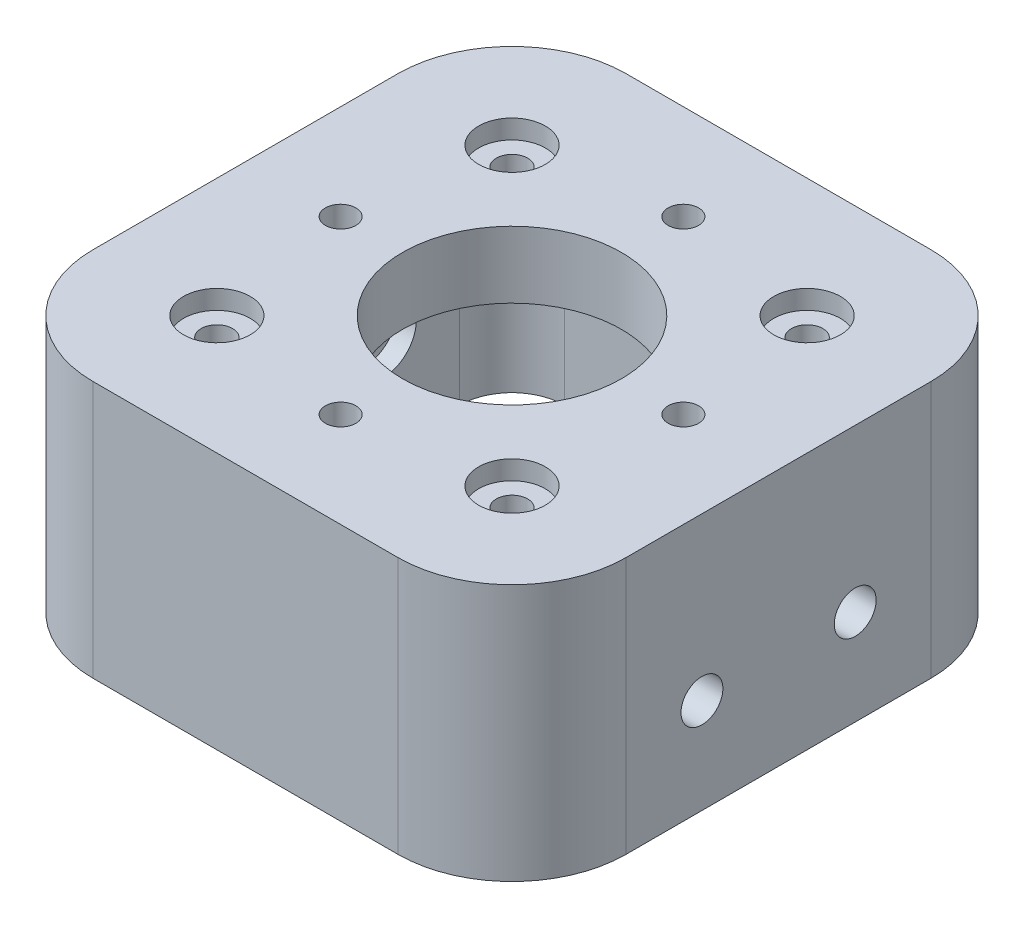
from build123d import *

# Parameters (mm, degrees)
SKETCH1_R           = 1.65
SKETCH1_R_2         = 11.5
BOSS_EXTRUDE1_DEPTH = 7
CUT_EXTRUDE3_DEPTH  = 3
BOSS_EXTRUDE4_START = -27
BOSS_EXTRUDE4_DEPTH = 27
CUT_EXTRUDE4_DEPTH  = 20
SKETCH7_R           = 2.2
CUT_EXTRUDE5_DEPTH  = 27
SKETCH8_R           = 3.5
CUT_EXTRUDE6_DEPTH  = 2
CUT_EXTRUDE7_START  = -8
SKETCH9_R           = 2.2
CUT_EXTRUDE7_DEPTH  = 8
CUT_EXTRUDE8_START  = -2
SKETCH10_R          = 3.5
CUT_EXTRUDE8_DEPTH  = 2
SKETCH11_R          = 3.5
CUT_EXTRUDE9_DEPTH  = 2
SKETCH12_R          = 1.6
CUT_EXTRUDE10_DEPTH = 7


with BuildPart() as part:
    # Sketch1 → Boss-Extrude1 (new body)
    with BuildSketch(Plane(origin=(0, 0, 0), x_dir=(1, 0, 0), z_dir=(0, 1, 0))):
        with BuildLine():
            Line((-35.480538417, 14.828911565), (-3.480538417, 14.828911565))
            ThreePointArc((-3.480538417, 14.828911565), (0.054995489, 13.364445471), (1.519461583, 9.828911565))
            Line((1.519461583, 9.828911565), (1.519461583, -22.171088435))
            ThreePointArc((1.519461583, -22.171088435), (0.054995489, -25.706622341), (-3.480538417, -27.171088435))
            Line((-3.480538417, -27.171088435), (-35.480538417, -27.171088435))
            ThreePointArc((-35.480538417, -27.171088435), (-39.016072323, -25.706622341), (-40.480538417, -22.171088435))
            Line((-40.480538417, -22.171088435), (-40.480538417, 9.828911565))
            ThreePointArc((-40.480538417, 9.828911565), (-39.016072323, 13.364445471), (-35.480538417, 14.828911565))
        make_face()
        with Locations(Location((-34.980538417, 9.328911565, 0), (0, 0, 270))):
            Circle(SKETCH1_R, mode=Mode.SUBTRACT)
        with Locations(Location((-3.980538417, 9.328911565, 0), (0, 0, 270))):
            Circle(SKETCH1_R, mode=Mode.SUBTRACT)
        with Locations(Location((-34.980538417, -21.671088435, 0), (0, 0, 270))):
            Circle(SKETCH1_R, mode=Mode.SUBTRACT)
        with Locations(Location((-3.980538417, -21.671088435, 0), (0, 0, 270))):
            Circle(SKETCH1_R, mode=Mode.SUBTRACT)
        with Locations(Location((-19.480538417, -6.171088435, 0), (0, 0, 270))):
            Circle(SKETCH1_R_2, mode=Mode.SUBTRACT)
    extrude(amount=BOSS_EXTRUDE1_DEPTH)

    # Sketch4 → Cut-Extrude3 (cut)
    with BuildSketch(Plane.XZ):
        Polygon((-22.480538417, 27.171088435), (-16.480538417, 27.171088435), (-16.480538417, 22.439037628), (-17.980538417, 21.573012224), (-19.480538417, 20.70698682), (-22.480538417, 22.439037628), align=None)
        Polygon((1.519461583, 3.171088435), (-3.212589224, 3.171088435), (-4.078614628, 4.671088435), (-4.944640032, 6.171088435), (-3.212589224, 9.171088435), (1.519461583, 9.171088435), align=None)
        Polygon((-22.480538417, -14.828911565), (-22.480538417, -10.096860757), (-20.980538417, -9.230835353), (-19.480538417, -8.364809949), (-16.480538417, -10.096860757), (-16.480538417, -14.828911565), align=None)
        Polygon((-40.480538417, 9.171088435), (-35.748487609, 9.171088435), (-34.882462206, 7.671088435), (-34.016436802, 6.171088435), (-35.748487609, 3.171088435), (-40.480538417, 3.171088435), align=None)
    extrude(amount=-CUT_EXTRUDE3_DEPTH, mode=Mode.SUBTRACT)

    # Sketch5 → Boss-Extrude4 (add)
    with BuildSketch(Plane(origin=(0, 7, 0), x_dir=(1, 0, 0), z_dir=(0, 1, 0)).offset(BOSS_EXTRUDE4_START)):
        with BuildLine():
            Line((-47.480538417, 9.828911565), (-47.480538417, -22.171088435))
            ThreePointArc((-47.480538417, -22.171088435), (-43.965819791, -30.65636981), (-35.480538417, -34.171088435))
            Line((-35.480538417, -34.171088435), (-3.480538417, -34.171088435))
            ThreePointArc((-3.480538417, -34.171088435), (5.004742957, -30.65636981), (8.519461583, -22.171088435))
            Line((8.519461583, -22.171088435), (8.519461583, 9.828911565))
            ThreePointArc((8.519461583, 9.828911565), (5.004742957, 18.314192939), (-3.480538417, 21.828911565))
            Line((-3.480538417, 21.828911565), (-35.480538417, 21.828911565))
            ThreePointArc((-35.480538417, 21.828911565), (-43.965819791, 18.314192939), (-47.480538417, 9.828911565))
        make_face()
        with BuildLine():
            ThreePointArc((-35.480538417, 14.828911565), (-39.016072323, 13.364445471), (-40.480538417, 9.828911565))
            Line((-40.480538417, 9.828911565), (-40.480538417, -22.171088435))
            ThreePointArc((-40.480538417, -22.171088435), (-39.016072323, -25.706622341), (-35.480538417, -27.171088435))
            Line((-35.480538417, -27.171088435), (-3.480538417, -27.171088435))
            ThreePointArc((-3.480538417, -27.171088435), (0.054995489, -25.706622341), (1.519461583, -22.171088435))
            Line((1.519461583, -22.171088435), (1.519461583, 9.828911565))
            ThreePointArc((1.519461583, 9.828911565), (0.054995489, 13.364445471), (-3.480538417, 14.828911565))
            Line((-3.480538417, 14.828911565), (-35.480538417, 14.828911565))
        make_face(mode=Mode.SUBTRACT)
    extrude(amount=BOSS_EXTRUDE4_DEPTH)

    # Sketch6 → Cut-Extrude4 (cut)
    with BuildSketch(Plane.XZ.offset(20)):
        with BuildLine():
            Line((2.119461583, 22.271088435), (2.119461583, -9.928911565))
            ThreePointArc((2.119461583, -9.928911565), (0.50854888, -13.817998861), (-3.380538417, -15.428911565))
            Line((-3.380538417, -15.428911565), (-35.580538417, -15.428911565))
            ThreePointArc((-35.580538417, -15.428911565), (-39.469625713, -13.817998861), (-41.080538417, -9.928911565))
            Line((-41.080538417, -9.928911565), (-41.080538417, 22.271088435))
            ThreePointArc((-41.080538417, 22.271088435), (-39.469625713, 26.160175732), (-35.580538417, 27.771088435))
            Line((-35.580538417, 27.771088435), (-3.380538417, 27.771088435))
            ThreePointArc((-3.380538417, 27.771088435), (0.50854888, 26.160175732), (2.119461583, 22.271088435))
        make_face()
    extrude(amount=-CUT_EXTRUDE4_DEPTH, mode=Mode.SUBTRACT)

    # Sketch7 → Cut-Extrude5 (cut)
    with BuildSketch(Plane.ZY.offset(-2.119461583)):
        with Locations((-1.878911565, -10)):
            Circle(SKETCH7_R)
        with Locations((14.221088435, -10)):
            Circle(SKETCH7_R)
    extrude(amount=-CUT_EXTRUDE5_DEPTH, mode=Mode.SUBTRACT)

    # Sketch8 → Cut-Extrude6 (cut)
    with BuildSketch(Plane.ZY.offset(-2.119461583)):
        with Locations((-1.878911565, -10)):
            Circle(SKETCH8_R)
        with Locations((14.221088435, -10)):
            Circle(SKETCH8_R)
    extrude(amount=-CUT_EXTRUDE6_DEPTH, mode=Mode.SUBTRACT)

    # Sketch9 → Cut-Extrude7 (cut)
    with BuildSketch(Plane(origin=(-41.080538417, 0, 0), x_dir=(0, 0, -1), z_dir=(1, 0, 0)).offset(CUT_EXTRUDE7_START)):
        with Locations(Location((-14.221088435, -10, 0), (0, 0, 180))):
            Circle(SKETCH9_R)
        with Locations(Location((1.878911565, -10, 0), (0, 0, 180))):
            Circle(SKETCH9_R)
    extrude(amount=CUT_EXTRUDE7_DEPTH, mode=Mode.SUBTRACT)

    # Sketch10 → Cut-Extrude8 (cut)
    with BuildSketch(Plane(origin=(-41.080538417, 0, 0), x_dir=(0, 0, -1), z_dir=(1, 0, 0)).offset(CUT_EXTRUDE8_START)):
        with Locations(Location((-14.221088435, -10, 0), (0, 0, 180))):
            Circle(SKETCH10_R)
        with Locations(Location((1.878911565, -10, 0), (0, 0, 180))):
            Circle(SKETCH10_R)
    extrude(amount=CUT_EXTRUDE8_DEPTH, mode=Mode.SUBTRACT)

    # Sketch11 → Cut-Extrude9 (cut)
    with BuildSketch(Plane(origin=(0, 7, 0), x_dir=(1, 0, 0), z_dir=(0, 1, 0))):
        with Locations(Location((-34.980538417, 9.328911565, 0), (0, 0, 270))):
            Circle(SKETCH11_R)
        with Locations(Location((-3.980538417, 9.328911565, 0), (0, 0, 270))):
            Circle(SKETCH11_R)
        with Locations(Location((-34.980538417, -21.671088435, 0), (0, 0, 270))):
            Circle(SKETCH11_R)
        with Locations(Location((-3.980538417, -21.671088435, 0), (0, 0, 270))):
            Circle(SKETCH11_R)
    extrude(amount=-CUT_EXTRUDE9_DEPTH, mode=Mode.SUBTRACT)

    # Sketch12 → Cut-Extrude10 (cut)
    with BuildSketch(Plane(origin=(0, 7, 0), x_dir=(1, 0, 0), z_dir=(0, 1, 0))):
        with Locations(Location((-19.480538417, 11.828911565, 0), (0, 0, 270))):
            Circle(SKETCH12_R)
        with Locations(Location((-37.480538417, -6.171088435, 0), (0, 0, 270))):
            Circle(SKETCH12_R)
        with Locations(Location((-19.480538417, -24.171088435, 0), (0, 0, 270))):
            Circle(SKETCH12_R)
        with Locations(Location((-1.480538417, -6.171088435, 0), (0, 0, 270))):
            Circle(SKETCH12_R)
    extrude(amount=-CUT_EXTRUDE10_DEPTH, mode=Mode.SUBTRACT)


solid = part.part
